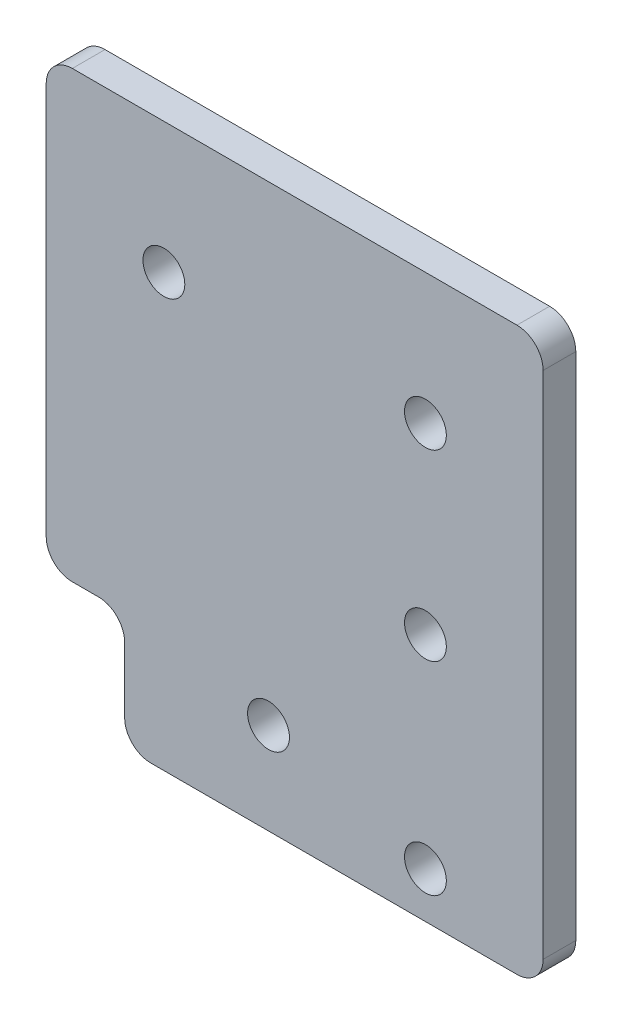
from build123d import *

# Parameters (mm, degrees)
SKETCH_1_R      = 1.6
EXTRUDE_1_DEPTH = 2.5
FILLET_2_R      = 2


with BuildPart() as part:
    # 草图1 → 凸台-拉伸1 (new body)
    with BuildSketch(Plane.XY):
        Polygon((-19, 17), (19, 17), (19, -26), (-13, -26), (-13, -17), (-19, -17), align=None)
        with Locations((10, 7)):
            Circle(SKETCH_1_R, mode=Mode.SUBTRACT)
        with Locations((-10, 7)):
            Circle(SKETCH_1_R, mode=Mode.SUBTRACT)
        with Locations((10, -22.5)):
            Circle(SKETCH_1_R, mode=Mode.SUBTRACT)
        with Locations((10, -7)):
            Circle(SKETCH_1_R, mode=Mode.SUBTRACT)
        with Locations((-2, -19)):
            Circle(SKETCH_1_R, mode=Mode.SUBTRACT)
    extrude(amount=EXTRUDE_1_DEPTH)

    # 圆角2
    fillet_2_edges = [part.edges().sort_by_distance(p)[0] for p in [
        (-19, 17, 1.25),
        (19, 17, 1.25),
        (19, -26, 1.25),
        (-13, -26, 1.25),
        (-13, -17, 1.25),
        (-19, -17, 1.25),
    ]]
    fillet(fillet_2_edges, radius=FILLET_2_R)


solid = part.part
